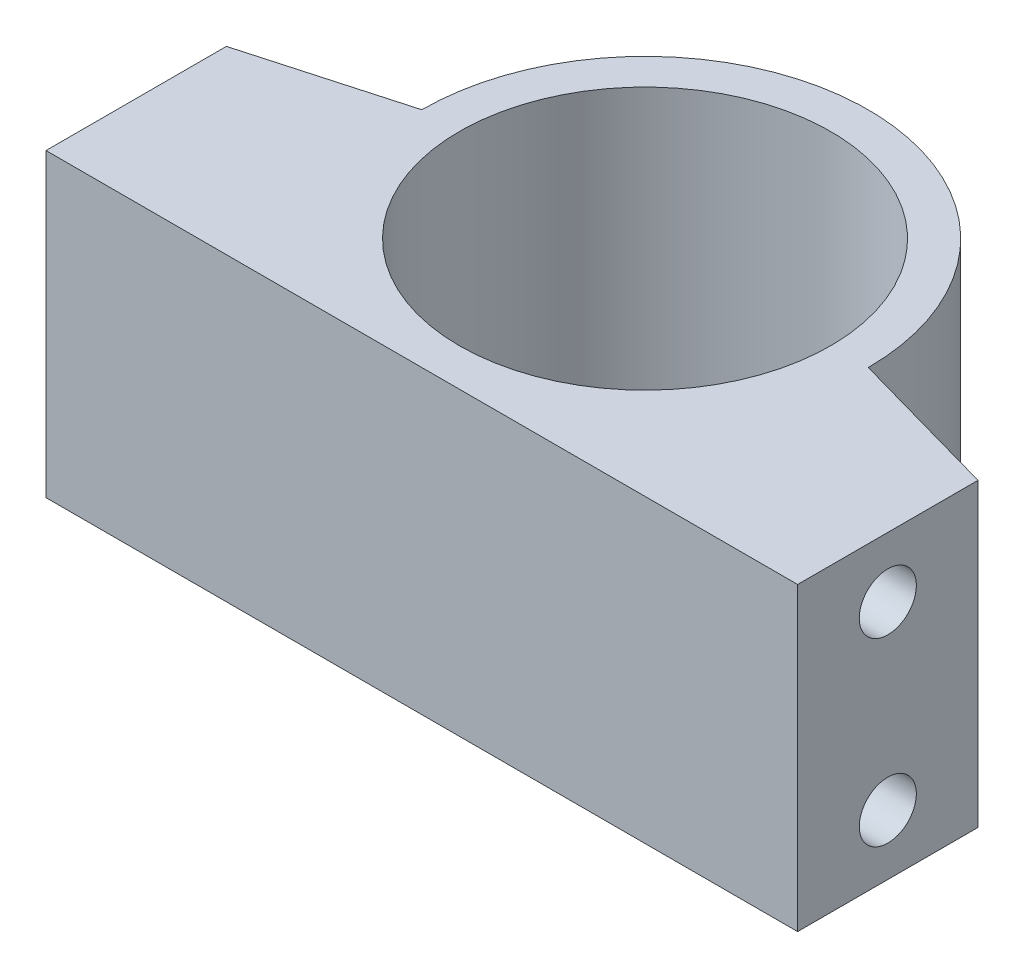
from build123d import *

# Parameters (mm, degrees)
SKETCH1_R               = 12.35
BOSS_EXTRUDE1_DEPTH     = 20
SKETCH1_5_R             = 12.35
SKETCH1_5_R_2           = 1.35
SKETCH1_5_R_3           = 4.5
BOSS_EXTRUDE2_DEPTH     = 1.7
CUT_EXTRUDE1_DEPTH      = 32
CUT_EXTRUDE1_DEPTH_BACK = 30
SKETCH2_R               = 1.9


with BuildPart() as part:
    # Sketch1 → Boss-Extrude1 (new body)
    with BuildSketch(Plane(origin=(0, 0, 0), x_dir=(1, 0, 0), z_dir=(0, 1, 0))):
        with BuildLine():
            ThreePointArc((0, -14.85), (10.500535701, 10.500535701), (-14.85, 0))
            Line((-14.85, 0), (-25, -2.85))
            Line((-25, -2.85), (-25, -14.85))
            Line((-25, -14.85), (0, -14.85))
        make_face()
        Circle(SKETCH1_R, mode=Mode.SUBTRACT)
    boss_extrude1 = extrude(amount=BOSS_EXTRUDE1_DEPTH)

    # Sketch1<5> → Boss-Extrude2 (add)
    with BuildSketch(Plane(origin=(0, 0, 0), x_dir=(1, 0, 0), z_dir=(0, 1, 0))):
        Circle(SKETCH1_5_R)
        with Locations((0, -8.35)):
            Circle(SKETCH1_5_R_2, mode=Mode.SUBTRACT)
        Circle(SKETCH1_5_R_3, mode=Mode.SUBTRACT)
        with Locations((0, 8.35)):
            Circle(SKETCH1_5_R_2, mode=Mode.SUBTRACT)
    extrude(amount=BOSS_EXTRUDE2_DEPTH)

    # Mirror1: Boss-Extrude1 across plane
    add(boss_extrude1.mirror(Plane(origin=(0, 0, 0), x_dir=(0, 0, 1), z_dir=(1, 0, 0))))

    # Sketch2 → Cut-Extrude1 (cut, two sides: drawn at the far end of the back side and taken through both)
    with BuildSketch(Plane(origin=(0, 0, 0), x_dir=(0, 0, -1), z_dir=(1, 0, 0)).offset(-CUT_EXTRUDE1_DEPTH_BACK)):
        with Locations((-8.85, 4)):
            Circle(SKETCH2_R)
        with Locations((-8.85, 16)):
            Circle(SKETCH2_R)
    extrude(amount=CUT_EXTRUDE1_DEPTH + CUT_EXTRUDE1_DEPTH_BACK, mode=Mode.SUBTRACT)


solid = part.part
